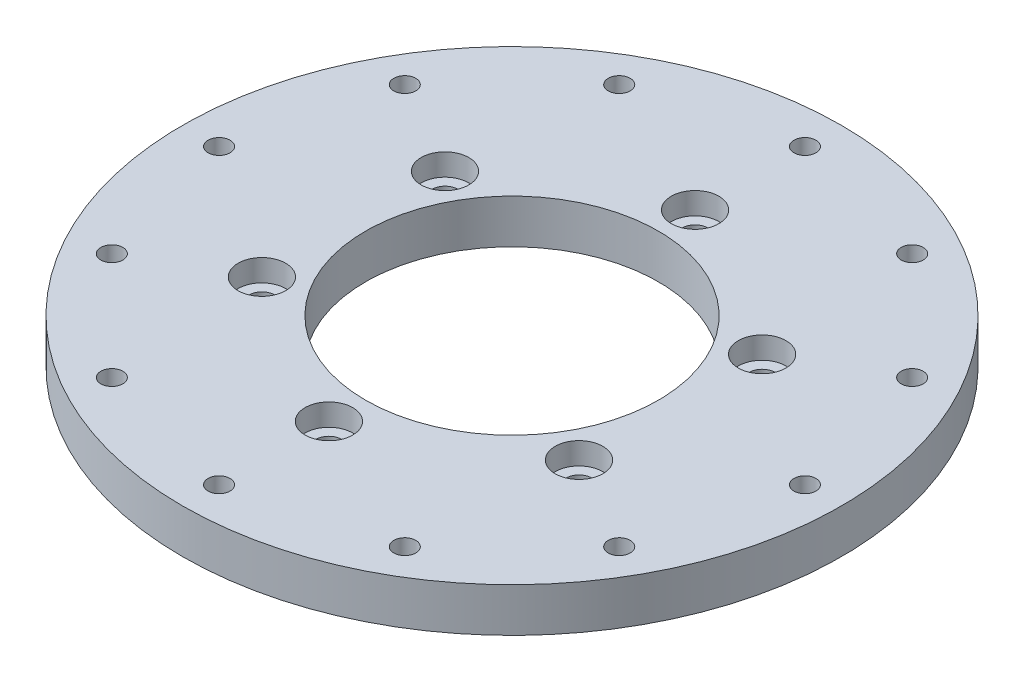
from build123d import *

# Parameters (mm, degrees)
SKETCH1_R           = 45
BOSS_EXTRUDE1_DEPTH = 6
SKETCH3_R           = 1.75
CUT_EXTRUDE1_DEPTH  = 64.921827258
SKETCH4_R           = 3.25
CUT_EXTRUDE2_DEPTH  = 3
SKETCH5_R           = 1.5
CUT_EXTRUDE3_DEPTH  = 64.921827258
CUT_EXTRUDE4_DEPTH  = 3
SKETCH9_R           = 20
CUT_EXTRUDE5_DEPTH  = 64.921827258


with BuildPart() as part:
    # Sketch1 → Boss-Extrude1 (new body)
    with BuildSketch(Plane(origin=(0, 0, 0), x_dir=(1, 0, 0), z_dir=(0, 1, 0))):
        with Locations(Location((0, 0, 0), (0, 0, 270))):
            Circle(SKETCH1_R)
    extrude(amount=BOSS_EXTRUDE1_DEPTH)

    # Sketch3 → Cut-Extrude1 (cut, through all)
    with BuildSketch(Plane(origin=(0, 6, 0), x_dir=(1, 0, 0), z_dir=(0, 1, 0))):
        with Locations(Location((0, -25, 0), (0, 0, 270))):
            Circle(SKETCH3_R)
        with Locations(Location((-21.650635095, -12.5, 0), (0, 0, 270))):
            Circle(SKETCH3_R)
        with Locations(Location((-21.650635095, 12.5, 0), (0, 0, 270))):
            Circle(SKETCH3_R)
        with Locations(Location((0, 25, 0), (0, 0, 270))):
            Circle(SKETCH3_R)
        with Locations(Location((21.650635095, 12.5, 0), (0, 0, 270))):
            Circle(SKETCH3_R)
        with Locations(Location((21.650635095, -12.5, 0), (0, 0, 270))):
            Circle(SKETCH3_R)
    extrude(amount=-CUT_EXTRUDE1_DEPTH, mode=Mode.SUBTRACT)

    # Sketch4 → Cut-Extrude2 (cut)
    with BuildSketch(Plane(origin=(0, 6, 0), x_dir=(1, 0, 0), z_dir=(0, 1, 0))):
        with Locations(Location((0, -25, 0), (0, 0, 270))):
            Circle(SKETCH4_R)
        with Locations(Location((-21.650635095, -12.5, 0), (0, 0, 270))):
            Circle(SKETCH4_R)
        with Locations(Location((-21.650635095, 12.5, 0), (0, 0, 270))):
            Circle(SKETCH4_R)
        with Locations(Location((0, 25, 0), (0, 0, 270))):
            Circle(SKETCH4_R)
        with Locations(Location((21.650635095, 12.5, 0), (0, 0, 270))):
            Circle(SKETCH4_R)
        with Locations(Location((21.650635095, -12.5, 0), (0, 0, 270))):
            Circle(SKETCH4_R)
    extrude(amount=-CUT_EXTRUDE2_DEPTH, mode=Mode.SUBTRACT)

    # Sketch5 → Cut-Extrude3 (cut, through all)
    with BuildSketch(Plane(origin=(0, 6, 0), x_dir=(1, 0, 0), z_dir=(0, 1, 0))):
        with Locations(Location((0, -40, 0), (0, 0, 270))):
            Circle(SKETCH5_R)
        with Locations(Location((-20, -34.641016151, 0), (0, 0, 270))):
            Circle(SKETCH5_R)
        with Locations(Location((-34.641016151, -20, 0), (0, 0, 270))):
            Circle(SKETCH5_R)
        with Locations(Location((-40, 0, 0), (0, 0, 270))):
            Circle(SKETCH5_R)
        with Locations(Location((-34.641016151, 20, 0), (0, 0, 270))):
            Circle(SKETCH5_R)
        with Locations(Location((-20, 34.641016151, 0), (0, 0, 270))):
            Circle(SKETCH5_R)
        with Locations(Location((0, 40, 0), (0, 0, 270))):
            Circle(SKETCH5_R)
        with Locations(Location((20, 34.641016151, 0), (0, 0, 270))):
            Circle(SKETCH5_R)
        with Locations(Location((34.641016151, 20, 0), (0, 0, 270))):
            Circle(SKETCH5_R)
        with Locations(Location((40, 0, 0), (0, 0, 270))):
            Circle(SKETCH5_R)
        with Locations(Location((34.641016151, -20, 0), (0, 0, 270))):
            Circle(SKETCH5_R)
        with Locations(Location((20, -34.641016151, 0), (0, 0, 270))):
            Circle(SKETCH5_R)
    extrude(amount=-CUT_EXTRUDE3_DEPTH, mode=Mode.SUBTRACT)

    # Sketch6 → Cut-Extrude4 (cut)
    with BuildSketch(Plane.XZ):
        Polygon((-18.267949192, -37.641016151), (-16.535898385, -34.641016151), (-18.267949192, -31.641016151), (-21.732050808, -31.641016151), (-23.464101615, -34.641016151), (-21.732050808, -37.641016151), align=None)
        Polygon((0, -36.535898385), (-3, -38.267949192), (-3, -41.732050808), (0, -43.464101615), (3, -41.732050808), (3, -38.267949192), align=None)
        Polygon((-34.641016151, -23.464101615), (-31.641016151, -21.732050808), (-31.641016151, -18.267949192), (-34.641016151, -16.535898385), (-37.641016151, -18.267949192), (-37.641016151, -21.732050808), align=None)
        Polygon((-41.732050808, -3), (-38.267949192, -3), (-36.535898385, 0), (-38.267949192, 3), (-41.732050808, 3), (-43.464101615, 0), align=None)
        Polygon((-37.641016151, 18.267949192), (-34.641016151, 16.535898385), (-31.641016151, 18.267949192), (-31.641016151, 21.732050808), (-34.641016151, 23.464101615), (-37.641016151, 21.732050808), align=None)
        Polygon((-23.464101615, 34.641016151), (-21.732050808, 31.641016151), (-18.267949192, 31.641016151), (-16.535898385, 34.641016151), (-18.267949192, 37.641016151), (-21.732050808, 37.641016151), align=None)
        Polygon((-3, 41.732050808), (-3, 38.267949192), (0, 36.535898385), (3, 38.267949192), (3, 41.732050808), (0, 43.464101615), align=None)
        Polygon((18.267949192, 37.641016151), (16.535898385, 34.641016151), (18.267949192, 31.641016151), (21.732050808, 31.641016151), (23.464101615, 34.641016151), (21.732050808, 37.641016151), align=None)
        Polygon((34.641016151, 23.464101615), (31.641016151, 21.732050808), (31.641016151, 18.267949192), (34.641016151, 16.535898385), (37.641016151, 18.267949192), (37.641016151, 21.732050808), align=None)
        Polygon((41.732050808, 3), (38.267949192, 3), (36.535898385, 0), (38.267949192, -3), (41.732050808, -3), (43.464101615, 0), align=None)
        Polygon((37.641016151, -18.267949192), (34.641016151, -16.535898385), (31.641016151, -18.267949192), (31.641016151, -21.732050808), (34.641016151, -23.464101615), (37.641016151, -21.732050808), align=None)
        Polygon((23.464101615, -34.641016151), (21.732050808, -31.641016151), (18.267949192, -31.641016151), (16.535898385, -34.641016151), (18.267949192, -37.641016151), (21.732050808, -37.641016151), align=None)
    extrude(amount=-CUT_EXTRUDE4_DEPTH, mode=Mode.SUBTRACT)

    # Sketch9 → Cut-Extrude5 (cut, through all)
    with BuildSketch(Plane(origin=(0, 6, 0), x_dir=(1, 0, 0), z_dir=(0, 1, 0))):
        with Locations(Location((0, 0, 0), (0, 0, 270))):
            Circle(SKETCH9_R)
    extrude(amount=-CUT_EXTRUDE5_DEPTH, mode=Mode.SUBTRACT)


solid = part.part
